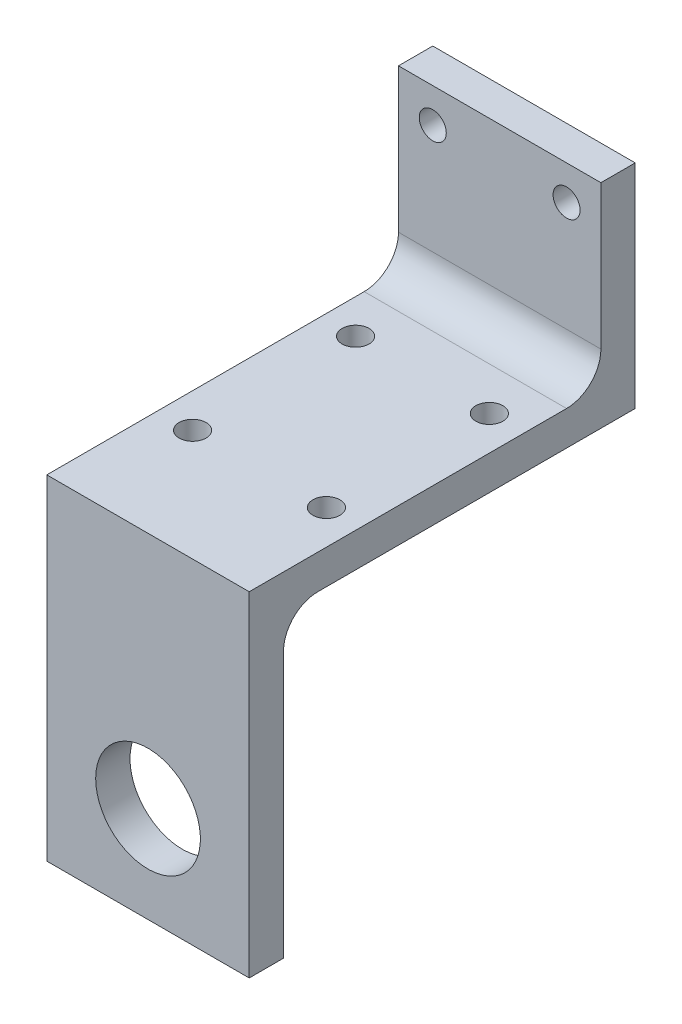
from build123d import *

# Parameters (mm, degrees)
BOSS_EXTRUDE1_DEPTH = 29.972
FILLET1_R           = 5.08
SKETCH3_R           = 2
SKETCH3_R_2         = 4
CUT_EXTRUDE1_DEPTH  = 5.08
SKETCH4_R           = 2
CUT_EXTRUDE2_DEPTH  = 29.972
SKETCH5_R           = 7.75
CUT_EXTRUDE3_DEPTH  = 5.08


with BuildPart() as part:
    # Sketch2 → Boss-Extrude1 (new body)
    with BuildSketch(Plane(origin=(0, 0, 0), x_dir=(0, 0, -1), z_dir=(1, 0, 0))):
        Polygon((10.419800113, 18.58115608), (10.419800113, -7.83484392), (-41.650199887, -7.83484392), (-41.650199887, -57.36484392), (-36.570199887, -57.36484392), (-36.570199887, -12.91484392), (15.499800113, -12.91484392), (15.499800113, 18.58115608), align=None)
    extrude(amount=BOSS_EXTRUDE1_DEPTH)

    # Fillet1
    fillet1_edges = [part.edges().sort_by_distance(p)[0] for p in [
        (14.986, -7.83484392, -10.419800113),
        (14.986, -12.91484392, 36.570199887),
    ]]
    fillet(fillet1_edges, radius=FILLET1_R)

    # Sketch3 → Cut-Extrude1 (cut)
    with BuildSketch(Plane(origin=(0, 0, -15.499800113), x_dir=(-1, 0, 0), z_dir=(0, 0, -1))):
        with Locations((-24.892, 13.50115608)):
            Circle(SKETCH3_R)
        with Locations((-5.08, 13.50115608)):
            Circle(SKETCH3_R)
        with Locations((-5.08, -10.62884392)):
            Circle(SKETCH3_R_2)
        with Locations((-24.892, -10.62884392)):
            Circle(SKETCH3_R_2)
    extrude(amount=-CUT_EXTRUDE1_DEPTH, mode=Mode.SUBTRACT)

    # Sketch4 → Cut-Extrude2 (cut)
    with BuildSketch(Plane.XZ.offset(12.91484392)):
        with Locations(Location((24.892, 1.010199887, 0), (0, 0, 270))):
            Circle(SKETCH4_R)
        with Locations(Location((5.08, 1.010199887, 0), (0, 0, 270))):
            Circle(SKETCH4_R)
        with Locations(Location((24.892, 25.140199887, 0), (0, 0, 270))):
            Circle(SKETCH4_R)
        with Locations(Location((5.08, 25.140199887, 0), (0, 0, 270))):
            Circle(SKETCH4_R)
    extrude(amount=-CUT_EXTRUDE2_DEPTH, mode=Mode.SUBTRACT)

    # Sketch5 → Cut-Extrude3 (cut)
    with BuildSketch(Plane(origin=(0, 0, 36.570199887), x_dir=(-1, 0, 0), z_dir=(0, 0, -1))):
        with Locations((-14.986, -43.14084392)):
            Circle(SKETCH5_R)
    extrude(amount=-CUT_EXTRUDE3_DEPTH, mode=Mode.SUBTRACT)


solid = part.part
